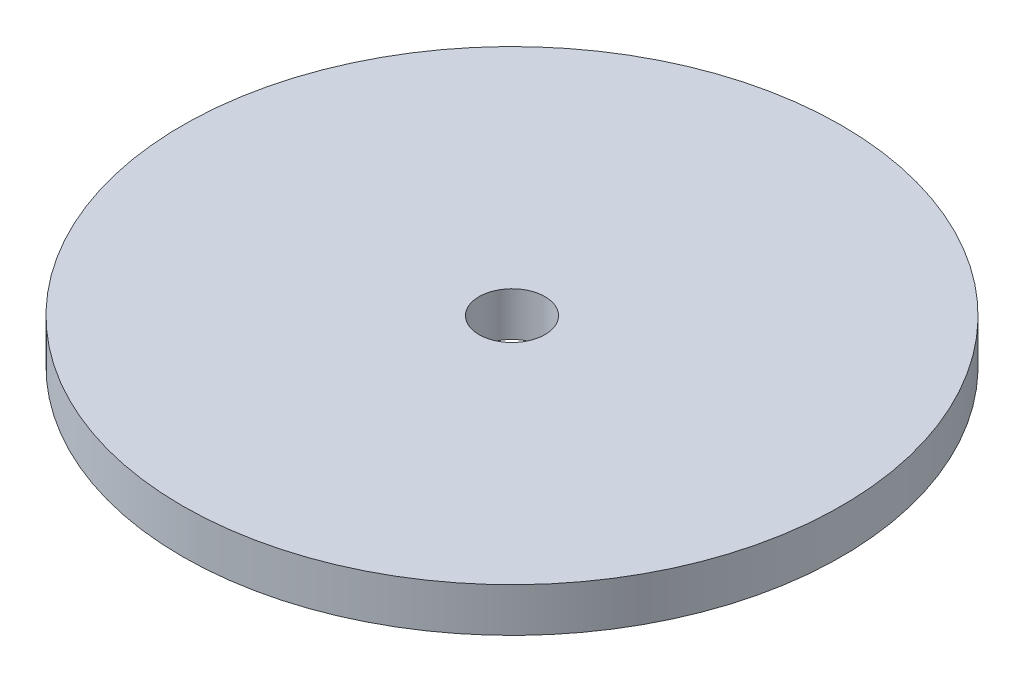
from build123d import *

# Parameters (mm, degrees)
SKIZZE1_R                       = 75
SKIZZE1_R_2                     = 7.5
AUFSATZ_LINEAR_AUSTRAGEN1_DEPTH = 10


with BuildPart() as part:
    # Skizze1 → Aufsatz-Linear austragen1 (new body)
    with BuildSketch(Plane(origin=(0, 0, 0), x_dir=(1, 0, 0), z_dir=(0, 1, 0))):
        with Locations(Location((0, 0, 0), (0, 0, 270))):
            Circle(SKIZZE1_R)
        with Locations(Location((0, 0, 0), (0, 0, 270))):
            Circle(SKIZZE1_R_2, mode=Mode.SUBTRACT)
    extrude(amount=AUFSATZ_LINEAR_AUSTRAGEN1_DEPTH)


solid = part.part
